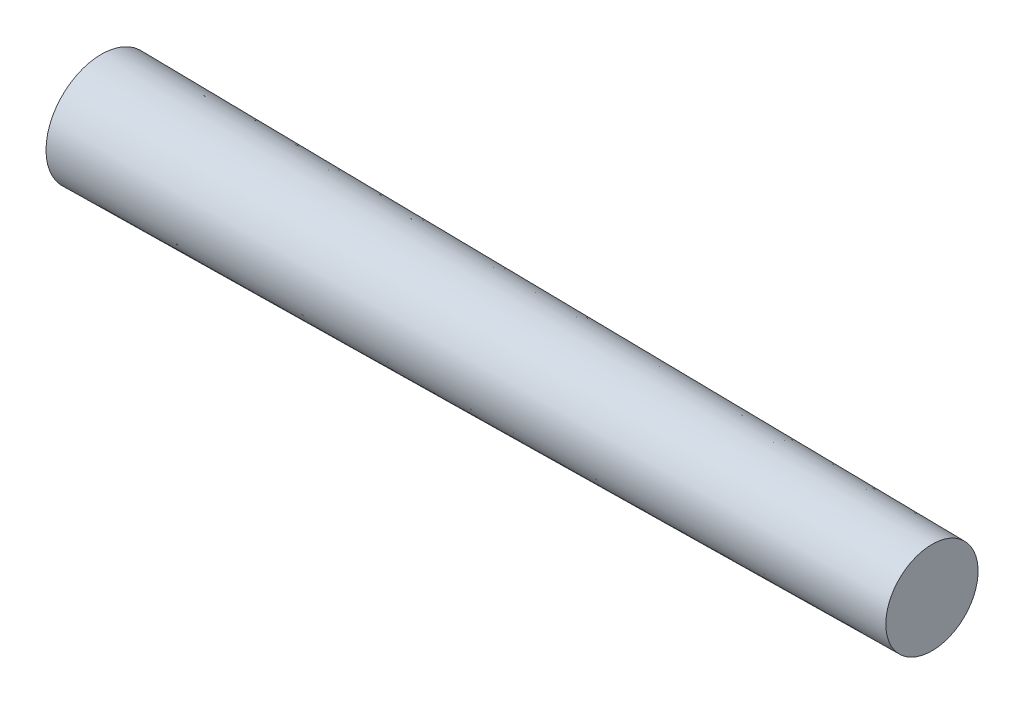
from build123d import *


with BuildPart() as part:
    # Sketch1 → Revolve1 (revolve)
    with BuildSketch(Plane.XY, mode=Mode.PRIVATE) as revolve1_sk:
        Polygon((0, 0), (0, 3), (45, 2.5), (45, 0), align=None)
    revolve(revolve1_sk.sketch.rotate(Axis((0, 0, 0), (1, 0, 0)), 90), axis=Axis((0, 0, 0), (1, 0, 0)))


solid = part.part
